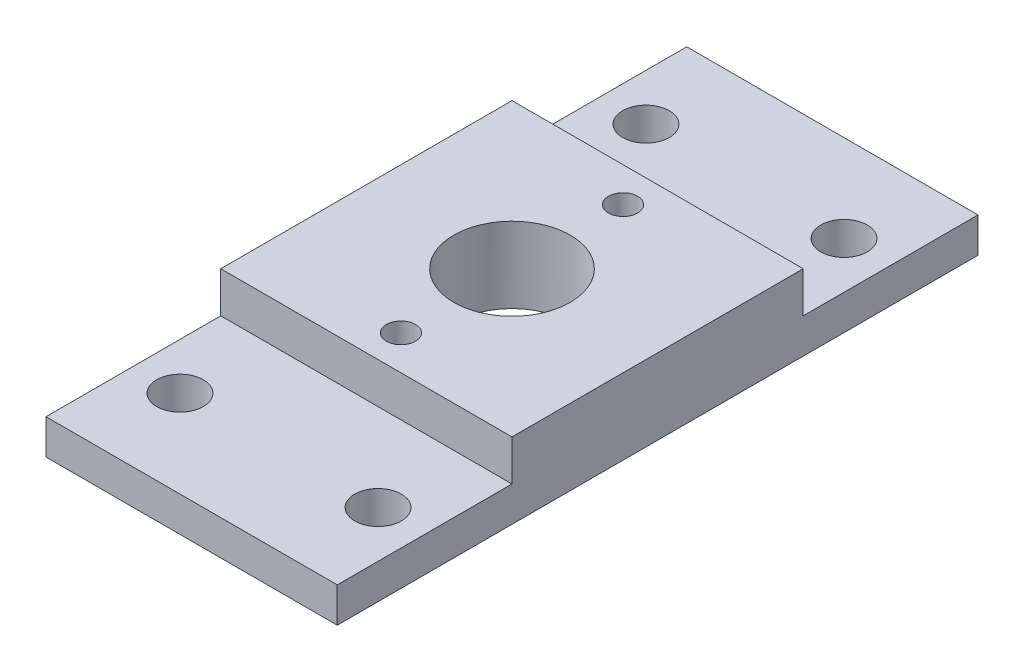
from build123d import *

# Parameters (mm, degrees)
BOSS_EXTRUDE1_DEPTH         = 12.5
BOSS_EXTRUDE1_DEPTH_BACK    = 12.5
SKETCH4_R                   = 2
CUT_EXTRUDE2_DEPTH          = 31.409702399
CUT_EXTRUDE3_REACH          = 32.899
SKETCH7_R                   = 5
TAP_DRILL_FOR_M3X0_5_TAP2_D = 2.5


with BuildPart() as part:
    # Sketch2 → Boss-Extrude1 (new, two sides: drawn at the far end of the back side and taken through both)
    with BuildSketch(Plane(origin=(0, 0, 0), x_dir=(0, 0, -1), z_dir=(1, 0, 0)).offset(-BOSS_EXTRUDE1_DEPTH_BACK)):
        Polygon((0, 0), (27.5, 0), (27.5, 3), (12.5, 3), (12.5, 6.5), (-12.5, 6.5), (-12.5, 3), (-27.5, 3), (-27.5, 0), align=None)
    extrude(amount=BOSS_EXTRUDE1_DEPTH + BOSS_EXTRUDE1_DEPTH_BACK)

    # Sketch4 → Cut-Extrude2 (cut, through all)
    with BuildSketch(Plane(origin=(0, 3, 0), x_dir=(1, 0, 0), z_dir=(0, 1, 0))):
        with Locations(Location((-8.5, 20, 0), (0, 0, 270))):
            Circle(SKETCH4_R)
        with Locations(Location((8.5, 20, 0), (0, 0, 90))):
            Circle(SKETCH4_R)
        with Locations(Location((8.5, -20, 0), (0, 0, 270))):
            Circle(SKETCH4_R)
        with Locations(Location((-8.5, -20, 0), (0, 0, 90))):
            Circle(SKETCH4_R)
    extrude(amount=-CUT_EXTRUDE2_DEPTH, mode=Mode.SUBTRACT)

    # Sketch7 → Cut-Extrude3 (cut, up to next)
    with BuildSketch(Plane(origin=(0, 6.5, 0), x_dir=(1, 0, 0), z_dir=(0, 1, 0)), mode=Mode.PRIVATE) as cut_extrude3_sk1:
        with Locations(Location((0, 0, 0), (0, 0, 270))):
            Circle(SKETCH7_R)
    cut_extrude3_tool1 = extrude(cut_extrude3_sk1.sketch, amount=-CUT_EXTRUDE3_REACH, mode=Mode.PRIVATE) & part.part
    add(cut_extrude3_tool1.solids().sort_by_distance((0, 6.5, 0))[0], mode=Mode.SUBTRACT)

    # Tap Drill for M3x0.5 Tap2 (through all)
    with Locations(Plane(origin=(0, 6.5, 0), x_dir=(1, 0, 0), z_dir=(0, 1, 0))):
        with Locations((0, 9.53), (0, -9.53)):
            Hole(TAP_DRILL_FOR_M3X0_5_TAP2_D / 2)


solid = part.part
